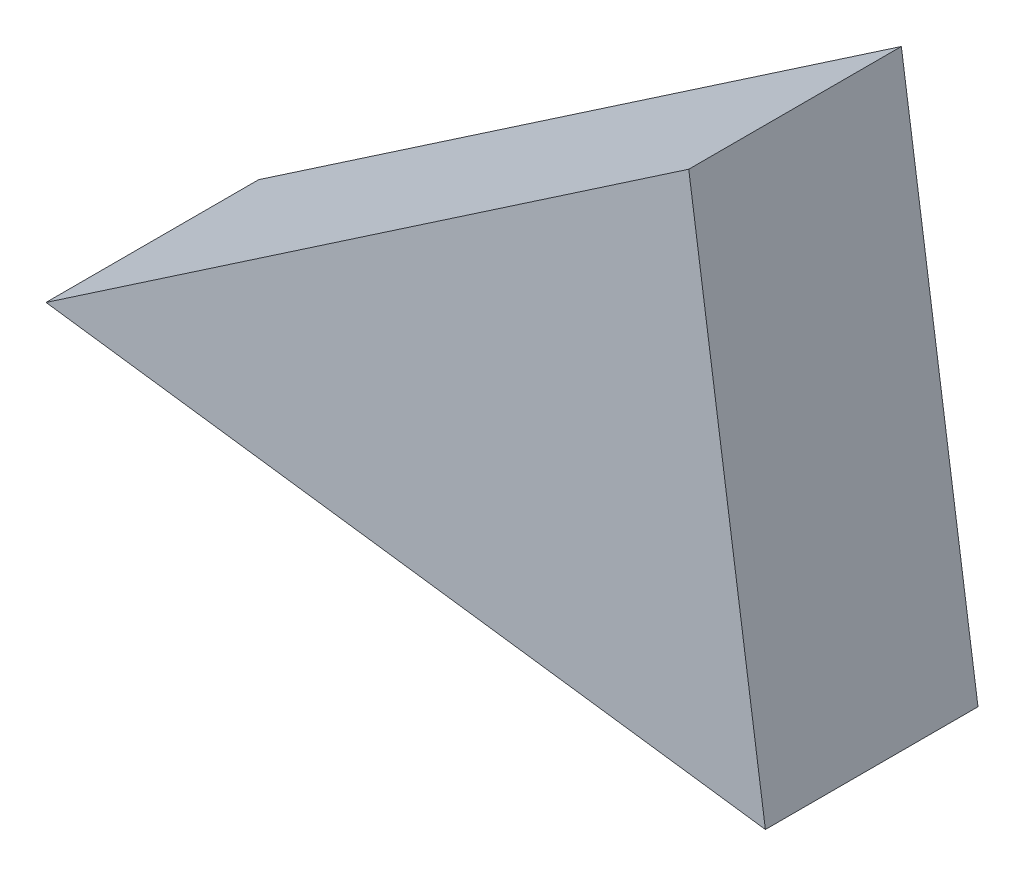
from build123d import *

# Parameters (mm, degrees)
EXTRUDE_1_DEPTH = 10


with BuildPart() as part:
    # 草图1 → 凸台-拉伸1 (new body)
    with BuildSketch(Plane.XY):
        Polygon((66.45088649, 44.287595488), (36.22095113, 23.74698866), (70.055914542, 19.194829802), align=None)
    extrude(amount=EXTRUDE_1_DEPTH)


solid = part.part
